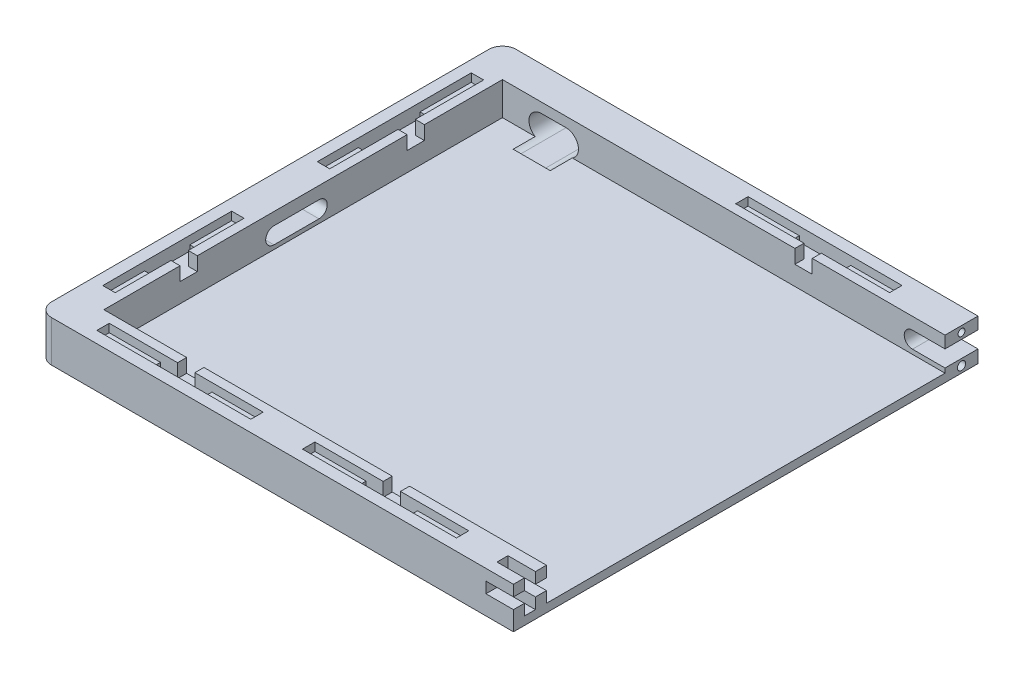
from build123d import *

# Parameters (mm, degrees)
SKETCH1_W           = 161
SKETCH1_H           = 145
BOSS_EXTRUDE1_DEPTH = 3
BOSS_EXTRUDE2_DEPTH = 15
CUT_EXTRUDE1_DEPTH  = 3
CUT_EXTRUDE2_DEPTH  = 2
CUT_EXTRUDE3_DEPTH  = 12
CUT_EXTRUDE5_DEPTH  = 12
CUT_EXTRUDE6_DEPTH  = 20
CUT_EXTRUDE8_DEPTH  = 10
FILLET2_R           = 5
FILLET3_R           = 5
SKETCH11_R          = 1.5
SKETCH11_R_2        = 1.25
CUT_EXTRUDE9_DEPTH  = 10


with BuildPart() as part:
    # Sketch1 → Boss-Extrude1 (new body)
    with BuildSketch(Plane(origin=(0, 0, 0), x_dir=(1, 0, 0), z_dir=(0, 1, 0))):
        with Locations((-80.5, 0)):
            Rectangle(SKETCH1_W, SKETCH1_H)
    extrude(amount=BOSS_EXTRUDE1_DEPTH)

    # Sketch2 → Boss-Extrude2 (add)
    with BuildSketch(Plane(origin=(0, 0, 0), x_dir=(1, 0, 0), z_dir=(0, 1, 0))):
        Polygon((0, 72.5), (0, 84.5), (-173, 84.5), (-173, -84.5), (0, -84.5), (0, -72.5), (-161, -72.5), (-161, 72.5), align=None)
    extrude(amount=BOSS_EXTRUDE2_DEPTH)

    # Sketch3 → Cut-Extrude1 (cut)
    with BuildSketch(Plane(origin=(0, 15, 0), x_dir=(1, 0, 0), z_dir=(0, 1, 0))):
        Polygon((-161, 44.1), (-161, 37.8), (-164.3, 37.8), (-164.3, 12.95), (-168.8, 12.95), (-168.8, 68.95), (-164.3, 68.95), (-164.3, 44.1), align=None)
        Polygon((-24.95, -75.8), (-49.8, -75.8), (-49.8, -72.5), (-56.1, -72.5), (-56.1, -75.8), (-80.95, -75.8), (-80.95, -80.3), (-24.95, -80.3), align=None)
        Polygon((-161, -38.5), (-161, -44.8), (-164.3, -44.8), (-164.3, -65.1), (-168.8, -65.1), (-168.8, -18.2), (-164.3, -18.2), (-164.3, -38.5), align=None)
        Polygon((-99.75, -80.3), (-99.75, -75.8), (-124.6, -75.8), (-124.6, -72.5), (-130.9, -72.5), (-130.9, -75.8), (-155.75, -75.8), (-155.75, -80.3), align=None)
        Polygon((-48.3, 75.8), (-48.3, 72.5), (-54.6, 72.5), (-54.6, 75.8), (-79.45, 75.8), (-79.45, 80.3), (-23.45, 80.3), (-23.45, 75.8), align=None)
    extrude(amount=-CUT_EXTRUDE1_DEPTH, mode=Mode.SUBTRACT)

    # Sketch4 → Cut-Extrude2 (cut)
    with BuildSketch(Plane(origin=(0, 12, 0), x_dir=(1, 0, 0), z_dir=(0, 1, 0))):
        Polygon((-54.6, 72.5), (-48.3, 72.5), (-48.3, 75.8), (-42.0875, 75.8), (-42.0875, 80.3), (-60.8125, 80.3), (-60.8125, 75.8), (-54.6, 75.8), align=None)
        Polygon((-161, 44.1), (-161, 37.8), (-164.3, 37.8), (-164.3, 27.850226284), (-168.8, 27.850226284), (-168.8, 50.3125), (-164.3, 50.3125), (-164.3, 44.1), align=None)
        Polygon((-168.8, -33.425), (-168.8, -49.875), (-164.3, -49.875), (-164.3, -44.8), (-161, -44.8), (-161, -38.5), (-164.3, -38.5), (-164.3, -33.425), align=None)
        Polygon((-130.9, -72.5), (-130.9, -75.8), (-137.1125, -75.8), (-137.1125, -80.3), (-118.3875, -80.3), (-118.3875, -75.8), (-124.6, -75.8), (-124.6, -72.5), align=None)
        Polygon((-56.1, -75.8), (-62.3125, -75.8), (-62.3125, -80.3), (-43.5875, -80.3), (-43.5875, -75.8), (-49.8, -75.8), (-49.8, -72.5), (-56.1, -72.5), align=None)
    extrude(amount=-CUT_EXTRUDE2_DEPTH, mode=Mode.SUBTRACT)

    # Sketch5 → Cut-Extrude3 (cut)
    with BuildSketch(Plane.ZY.offset(173)):
        with BuildLine():
            Line((-5.75, 10.5), (10.63, 10.5))
            ThreePointArc((10.63, 10.5), (13.63, 7.5), (10.63, 4.5))
            Line((10.63, 4.5), (-5.75, 4.5))
            ThreePointArc((-5.75, 4.5), (-8.75, 7.5), (-5.75, 10.5))
        make_face()
    extrude(amount=-CUT_EXTRUDE3_DEPTH, mode=Mode.SUBTRACT)

    # Sketch7 → Cut-Extrude5 (cut)
    with BuildSketch(Plane(origin=(0, 0, -84.5), x_dir=(-1, 0, 0), z_dir=(0, 0, -1))):
        with BuildLine():
            Line((-4.5375, 10.634328206), (11.8425, 10.634328206))
            ThreePointArc((11.8425, 10.634328206), (14.8425, 7.634328206), (11.8425, 4.634328206))
            Line((11.8425, 4.634328206), (-4.5375, 4.634328206))
            ThreePointArc((-4.5375, 4.634328206), (-7.5375, 7.634328206), (-4.5375, 10.634328206))
        make_face()
    extrude(amount=-CUT_EXTRUDE5_DEPTH, mode=Mode.SUBTRACT)

    # Sketch8 → Cut-Extrude6 (cut)
    with BuildSketch(Plane(origin=(0, 0, -84.5), x_dir=(-1, 0, 0), z_dir=(0, 0, -1))):
        with BuildLine():
            Line((137.86, 11.4), (146.86, 11.4))
            ThreePointArc((146.86, 11.4), (151.36, 6.9), (146.86, 2.4))
            Line((146.86, 2.4), (137.86, 2.4))
            ThreePointArc((137.86, 2.4), (133.36, 6.9), (137.86, 11.4))
        make_face()
    extrude(amount=-CUT_EXTRUDE6_DEPTH, mode=Mode.SUBTRACT)

    # Sketch10 → Cut-Extrude8 (cut)
    with BuildSketch(Plane(origin=(0, 0, 0), x_dir=(0, 0, -1), z_dir=(1, 0, 0))):
        Polygon((-80.5, 15), (-76.5, 15), (-76.5, 11), (-72.5, 11), (-72.5, 7), (-76.5, 7), (-76.5, 3), (-80.5, 3), (-80.5, 7), (-84.5, 7), (-84.5, 11), (-80.5, 11), align=None)
    extrude(amount=-CUT_EXTRUDE8_DEPTH, mode=Mode.SUBTRACT)

    # Fillet2
    fillet2_edges = [part.edges().sort_by_distance(p)[0] for p in [
        (-173, 7.5, 84.5),
    ]]
    fillet(fillet2_edges, radius=FILLET2_R)

    # Fillet3
    fillet3_edges = [part.edges().sort_by_distance(p)[0] for p in [
        (-173, 7.5, -84.5),
    ]]
    fillet(fillet3_edges, radius=FILLET3_R)

    # Sketch11 → Cut-Extrude9 (cut)
    with BuildSketch(Plane(origin=(0, 0, 0), x_dir=(0, 0, -1), z_dir=(1, 0, 0))):
        with Locations((78.5, 2.317164103)):
            Circle(SKETCH11_R)
        with Locations((78.5, 12.817164103)):
            Circle(SKETCH11_R_2)
    extrude(amount=-CUT_EXTRUDE9_DEPTH, mode=Mode.SUBTRACT)


solid = part.part
